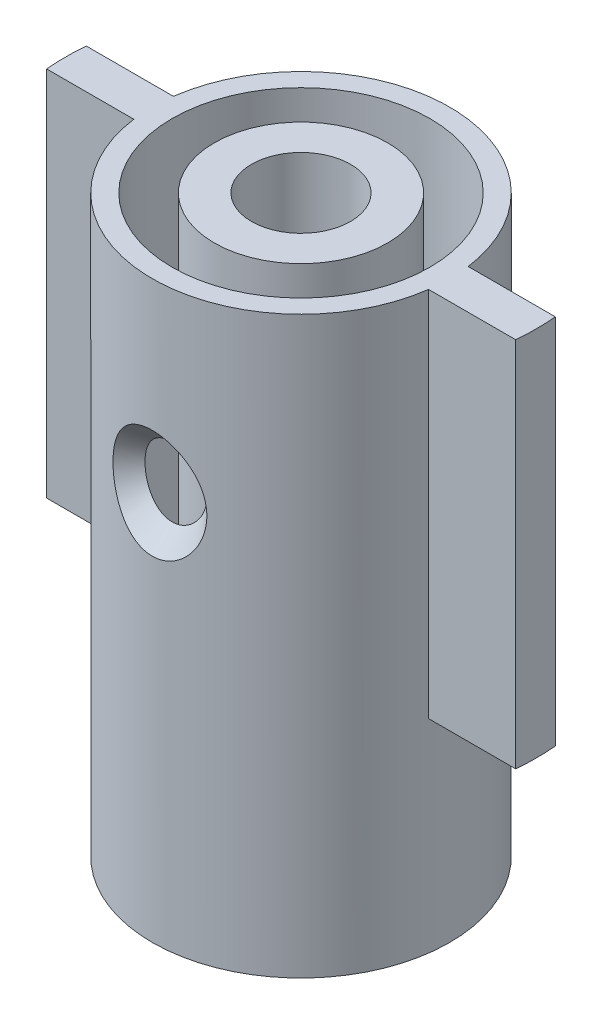
from build123d import *

# Parameters (mm, degrees)
SKETCH1_R           = 2
BOSS_EXTRUDE1_DEPTH = 20
SKETCH1_3_R         = 6
BOSS_EXTRUDE2_DEPTH = 3.2
SKETCH1_4_R         = 6
SKETCH1_4_R_2       = 3.5
BOSS_EXTRUDE3_DEPTH = 5
SKETCH2_R           = 5.2
BOSS_EXTRUDE4_DEPTH = 15
CIRPATTERN1_COUNT   = 2


with BuildPart() as part:
    # Sketch1 → Boss-Extrude1 (new body)
    with BuildSketch(Plane(origin=(0, 0, 0), x_dir=(1, 0, 0), z_dir=(0, 1, 0))):
        with BuildLine():
            ThreePointArc((1.750000074, -3.03108887), (3.031088935, -1.749999963), (3.5, 0))
            ThreePointArc((3.5, 0), (3.03108893, 1.749999971), (1.750000057, 3.03108888))
            ThreePointArc((1.750000057, 3.03108888), (8.8e-08, 3.5), (-1.749999906, 3.031088968))
            ThreePointArc((-1.749999906, 3.031088968), (-3.031088886, 1.750000047), (-3.5, 0))
            ThreePointArc((-3.5, 0), (-3.031088909, -1.750000007), (-1.749999986, -3.031088921))
            ThreePointArc((-1.749999986, -3.031088921), (5.1e-08, -3.5), (1.750000074, -3.03108887))
        make_face()
        Circle(SKETCH1_R, mode=Mode.SUBTRACT)
    extrude(amount=BOSS_EXTRUDE1_DEPTH)



with BuildPart() as body_2:
    # Sketch1<3> → Boss-Extrude2 (new body)
    with BuildSketch(Plane(origin=(0, 0, 0), x_dir=(1, 0, 0), z_dir=(0, 1, 0))):
        Circle(SKETCH1_3_R)
        Polygon((3.5, 0), (3.5, -2.020725942), (1.750000074, -3.03108887), (0, -4.041451884), (-1.749999986, -3.031088921), (-3.5, -2.020725942), (-3.5, 0), (-3.5, 2.020725942), (-1.749999906, 3.031088968), (0, 4.041451884), (1.750000057, 3.03108888), (3.5, 2.020725942), align=None, mode=Mode.SUBTRACT)
    extrude(amount=-BOSS_EXTRUDE2_DEPTH)


with BuildPart() as part_1:
    add(part.part)

    add(body_2.part)  # Boss-Extrude3 merges body 2
    # Sketch1<4> → Boss-Extrude3 (add)
    with BuildSketch(Plane(origin=(0, 0, 0), x_dir=(1, 0, 0), z_dir=(0, 1, 0))):
        Circle(SKETCH1_4_R)
        Circle(SKETCH1_4_R_2, mode=Mode.SUBTRACT)
    extrude(amount=BOSS_EXTRUDE3_DEPTH)

    # Sketch2 → Boss-Extrude4 (add)
    with BuildSketch(Plane(origin=(0, 5, 0), x_dir=(1, 0, 0), z_dir=(0, 1, 0))):
        with BuildLine():
            Line((-9.46625586, -0.8), (-5.946427499, -0.8))
            ThreePointArc((-5.946427499, -0.8), (0, -6), (5.946427499, -0.8))
            Line((5.946427499, -0.8), (9.46625586, -0.8))
            ThreePointArc((9.46625586, -0.8), (9.5, 0), (9.46625586, 0.8))
            Line((9.46625586, 0.8), (5.946427499, 0.8))
            ThreePointArc((5.946427499, 0.8), (0, 6), (-5.946427499, 0.8))
            Line((-5.946427499, 0.8), (-9.46625586, 0.8))
            ThreePointArc((-9.46625586, 0.8), (-9.5, 0), (-9.46625586, -0.8))
        make_face()
        Circle(SKETCH2_R, mode=Mode.SUBTRACT)
    extrude(amount=BOSS_EXTRUDE4_DEPTH)

    # Sketch5 → CSK for M2 Flat Head Machine Screw1 (revolve, cut)
    with BuildSketch(Plane(origin=(0, 12.5, -6), x_dir=(0, 1, 0), z_dir=(1, 0, 0))):
        Polygon((0, 0), (0, 5), (1.2, 4.278967257), (1.2, 1), (2.2, 0), align=None)
    csk_for_m2_flat_head_machine_screw1 = revolve(axis=Axis((0, 12.5, -12.35), (0, 0, 1)), mode=Mode.SUBTRACT)

    # CirPattern1: CSK for M2 Flat Head Machine Screw1 ×2 about axis
    cirpattern1_axis = Axis((0, 5, 0), (0, -1, 0))
    for i in range(1, CIRPATTERN1_COUNT):
        add(csk_for_m2_flat_head_machine_screw1.rotate(cirpattern1_axis, i * 360 / CIRPATTERN1_COUNT), mode=Mode.SUBTRACT)


solid = part_1.part
